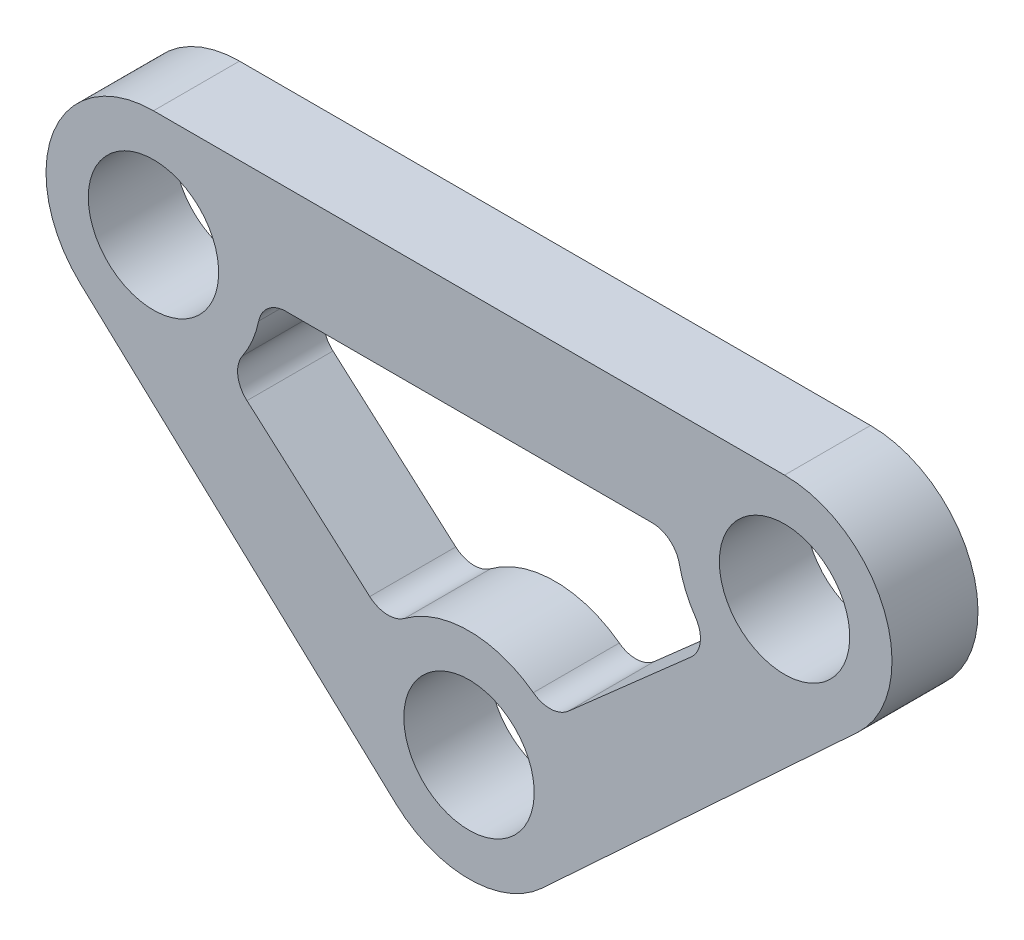
from build123d import *

# Parameters (mm, degrees)
SKETCH1_R      = 2.35
EXTRUDE1_DEPTH = 3.1


with BuildPart() as part:
    # Sketch1 → Extrude1 (new body)
    with BuildSketch(Plane.XY):
        with BuildLine():
            Line((-37.138157114, 29.933489293), (-14.388157114, 29.933489293))
            ThreePointArc((-14.388157114, 29.933489293), (-10.78087227, 27.473805885), (-11.7530861, 23.217358224))
            Line((-11.7530861, 23.217358224), (-23.1280861, 12.667358224))
            ThreePointArc((-23.1280861, 12.667358224), (-25.763157114, 11.633489293), (-28.398228128, 12.667358224))
            Line((-28.398228128, 12.667358224), (-39.773228128, 23.217358224))
            ThreePointArc((-39.773228128, 23.217358224), (-40.745441958, 27.473805885), (-37.138157114, 29.933489293))
        make_face()
        with Locations(Location((-14.388157114, 26.058489293, 0), (0, 0, 180))):
            Circle(SKETCH1_R, mode=Mode.SUBTRACT)
        with Locations(Location((-37.138157114, 26.058489293, 0), (0, 0, 180))):
            Circle(SKETCH1_R, mode=Mode.SUBTRACT)
        with Locations(Location((-25.763157114, 15.508489293, 0), (0, 0, 180))):
            Circle(SKETCH1_R, mode=Mode.SUBTRACT)
        with BuildLine():
            Line((-33.76750302, 22.568552775), (-29.341459115, 18.664654654))
            ThreePointArc((-29.341459115, 18.664654654), (-28.720659193, 18.415441082), (-28.081652728, 18.613356938))
            ThreePointArc((-28.081652728, 18.613356938), (-25.763157114, 19.383489293), (-23.4446615, 18.613356938))
            ThreePointArc((-23.4446615, 18.613356938), (-22.805655035, 18.415441082), (-22.184855112, 18.664654654))
            Line((-22.184855112, 18.664654654), (-17.758811208, 22.568552775))
            ThreePointArc((-17.758811208, 22.568552775), (-17.428169762, 23.19327051), (-17.593190704, 23.880558008))
            ThreePointArc((-17.593190704, 23.880558008), (-17.954657824, 24.543333299), (-18.180755673, 25.263617499))
            ThreePointArc((-18.180755673, 25.263617499), (-18.529065613, 25.834739319), (-19.159490785, 26.058489293))
            Line((-19.159490785, 26.058489293), (-32.366823443, 26.058489293))
            ThreePointArc((-32.366823443, 26.058489293), (-32.997248615, 25.834739319), (-33.345558555, 25.263617499))
            ThreePointArc((-33.345558555, 25.263617499), (-33.571656404, 24.543333299), (-33.933123524, 23.880558008))
            ThreePointArc((-33.933123524, 23.880558008), (-34.098144466, 23.19327051), (-33.76750302, 22.568552775))
        make_face(mode=Mode.SUBTRACT)
    extrude(amount=EXTRUDE1_DEPTH)


solid = part.part
